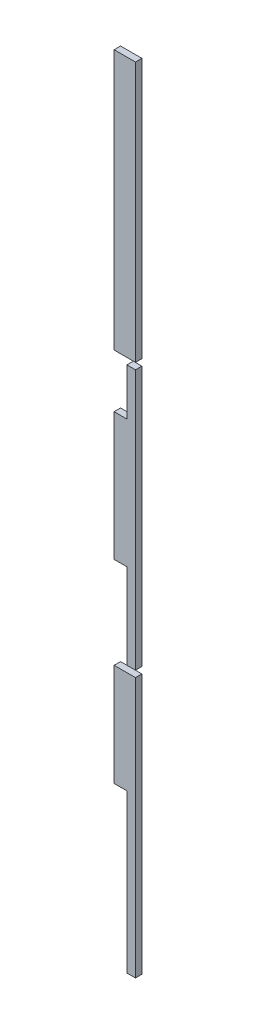
from build123d import *

# Parameters (mm, degrees)
SKETCH_1_W        = 10
SKETCH_1_H        = 122
EXTRUDE_1_DEPTH   = 3
EXTRUDE_1_2_DEPTH = 3
EXTRUDE_1_3_DEPTH = 3


with BuildPart() as part:
    # 草图1 → 凸台-拉伸1 (new body)
    with BuildSketch(Plane.XY):
        with Locations((125.787596038, -829.01)):
            Rectangle(SKETCH_1_W, SKETCH_1_H)
    extrude(amount=EXTRUDE_1_DEPTH)


with BuildPart() as body_2:
    # 草图1 → Extrude 1 2 (new body)
    with BuildSketch(Plane.XY):
        Polygon((120.787596038, -975.01), (126.787596038, -975.01), (126.787596038, -1015.01), (130.787596038, -1015.01), (130.787596038, -985.01), (130.787596038, -925.01), (130.787596038, -893.01), (126.787596038, -893.01), (126.787596038, -915.01), (120.787596038, -915.01), align=None)
    extrude(amount=EXTRUDE_1_2_DEPTH)


with BuildPart() as body_3:
    # 草图1 → Extrude 1 3 (new body)
    with BuildSketch(Plane.XY):
        Polygon((120.787596038, -1018.01), (130.787596038, -1018.01), (130.787596038, -1076.01), (130.787596038, -1140.01), (126.787596038, -1140.01), (126.787596038, -1066.01), (120.787596038, -1066.01), align=None)
    extrude(amount=EXTRUDE_1_3_DEPTH)


solid = Compound([part.part, body_2.part, body_3.part])
